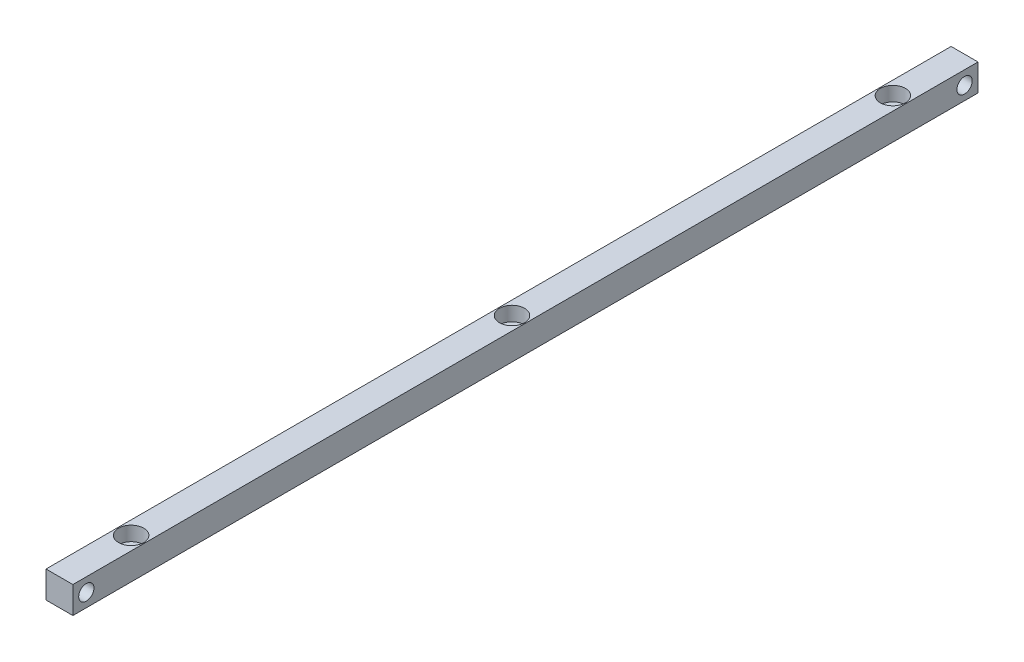
from build123d import *

# Parameters (mm, degrees)
IZIM1_W                     = 15
IZIM1_H                     = 15
Y_KSEKLIK_EKSTR_ZYON1_DEPTH = 252.5
DELIK2_D                    = 8.5
DELIK2_CBORE_D              = 14
DELIK2_CBORE_DEPTH          = 8
DELIK3_D                    = 8.5
DELIK3_CBORE_D              = 14
DELIK3_CBORE_DEPTH          = 8
L_O_ALTMA1_COUNT            = 3
L_O_ALTMA1_PITCH            = 212.5


with BuildPart() as part:
    # Çizim1 → Yükseklik-Ekstrüzyon1 (new, symmetric)
    with BuildSketch(Plane.XY):
        Rectangle(IZIM1_W, IZIM1_H)
    extrude(amount=Y_KSEKLIK_EKSTR_ZYON1_DEPTH, both=True)

    # Delik2 (through all)
    with Locations(Plane(origin=(-7.5, 0, 245), x_dir=(0, 0, -1), z_dir=(-1, 0, 0))):
        with Locations((0, 0)):
            delik2 = CounterBoreHole(DELIK2_D / 2, DELIK2_CBORE_D / 2, DELIK2_CBORE_DEPTH)

    # Aynalama1: Delik2 across plane
    add(delik2.mirror(Plane.XY), mode=Mode.SUBTRACT)

    # Delik3 (through all)
    with Locations(Plane(origin=(0, 7.5, 0), x_dir=(1, 0, 0), z_dir=(0, 1, 0))):
        with Locations((0, -212.5)):
            delik3 = CounterBoreHole(DELIK3_D / 2, DELIK3_CBORE_D / 2, DELIK3_CBORE_DEPTH)

    # LÇoğaltma1: Delik3 ×3
    with Locations(*[(0, 0, -i * L_O_ALTMA1_PITCH) for i in range(1, L_O_ALTMA1_COUNT)]):
        add(delik3, mode=Mode.SUBTRACT)


solid = part.part
